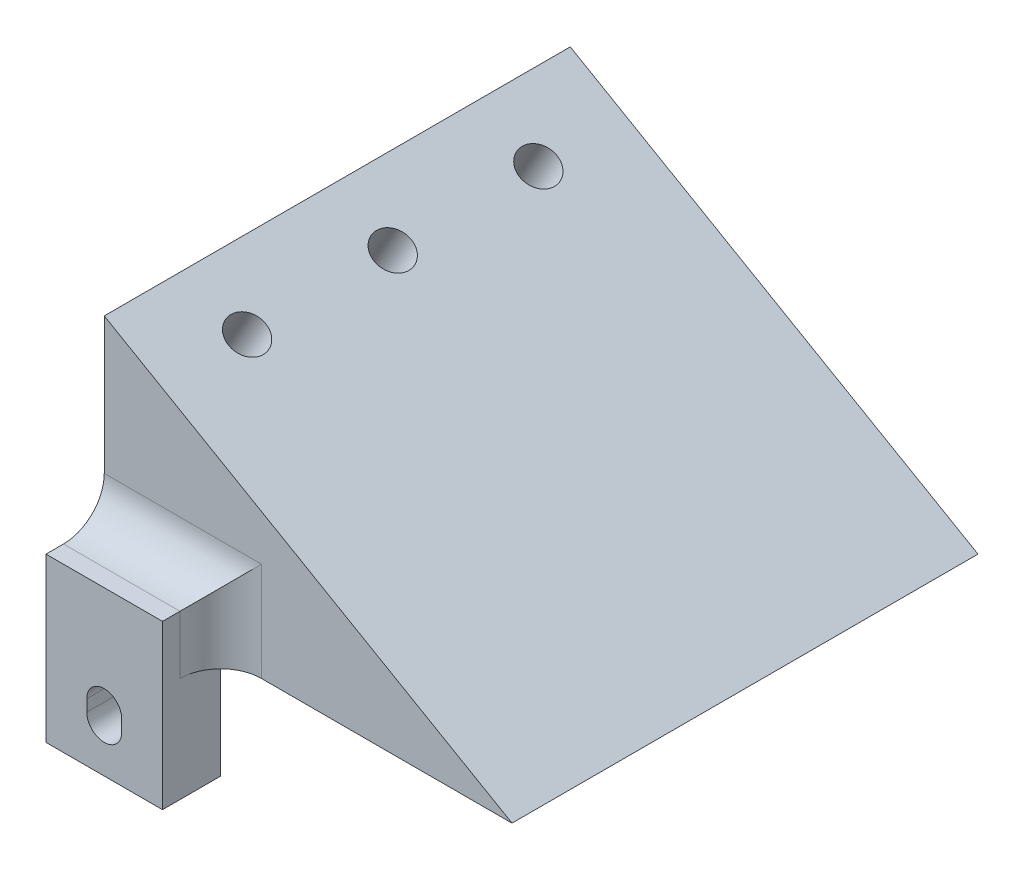
from build123d import *

# Parameters (mm, degrees)
BOSS_EXTRUDE1_DEPTH = 80
SKETCH2_W           = 20
SKETCH2_H           = 28
BOSS_EXTRUDE2_DEPTH = 10
FILLET1_R           = 7
CUT_EXTRUDE1_DEPTH  = 20
FILLET2_R           = 7
SKETCH4_R           = 3.2
CUT_EXTRUDE2_DEPTH  = 9.5


with BuildPart() as part:
    # Sketch1 → Boss-Extrude1 (new body)
    with BuildSketch(Plane.XY):
        Polygon((0, 0), (0, 40.414518843), (70, 0), align=None)
    extrude(amount=BOSS_EXTRUDE1_DEPTH)

    # Sketch2 → Boss-Extrude2 (add)
    with BuildSketch(Plane.XY.offset(80)):
        with Locations((10, -4)):
            Rectangle(SKETCH2_W, SKETCH2_H)
    boss_extrude2 = extrude(amount=BOSS_EXTRUDE2_DEPTH)

    # Fillet1
    fillet1_edges = [part.edges().sort_by_distance(p)[0] for p in [
        (20, 5, 80),
        (10, 10, 80),
    ]]
    fillet(fillet1_edges, radius=FILLET1_R)

    # Sketch3 → Cut-Extrude1 (cut)
    with BuildSketch(Plane.XY.offset(90)):
        with BuildLine():
            Line((7, -10), (7, -8))
            ThreePointArc((7, -8), (10, -5), (13, -8))
            Line((13, -8), (13, -10))
            ThreePointArc((13, -10), (10, -13), (7, -10))
        make_face()
    cut_extrude1 = extrude(amount=-CUT_EXTRUDE1_DEPTH, mode=Mode.SUBTRACT)

    # Mirror10: Boss-Extrude2, Cut-Extrude1 across plane
    add(boss_extrude2.mirror(Plane(origin=(0, 0, 40), x_dir=(1, 0, 0), z_dir=(0, 0, -1))))
    add(cut_extrude1.mirror(Plane(origin=(0, 0, 40), x_dir=(1, 0, 0), z_dir=(0, 0, -1))), mode=Mode.SUBTRACT)

    # Fillet2
    fillet2_edges = [part.edges().sort_by_distance(p)[0] for p in [
        (20, 5, 0),
        (10, 10, 0),
    ]]
    fillet(fillet2_edges, radius=FILLET2_R)

    # Sketch4 → Cut-Extrude2 (cut)
    with BuildSketch(Plane(origin=(17.5, 30.310889132, 0), x_dir=(0.8660254037844418, -0.49999999999999456, 0), z_dir=(0.4999999999999946, 0.8660254037844419, 0))):
        with Locations(Location((-9.207259422, -15, 0), (0, 0, 180))):
            Circle(SKETCH4_R)
        with Locations(Location((-9.207259422, -40, 0), (0, 0, 180))):
            Circle(SKETCH4_R)
        with Locations(Location((-9.207259422, -65, 0), (0, 0, 180))):
            Circle(SKETCH4_R)
    extrude(amount=-CUT_EXTRUDE2_DEPTH, mode=Mode.SUBTRACT)


solid = part.part
